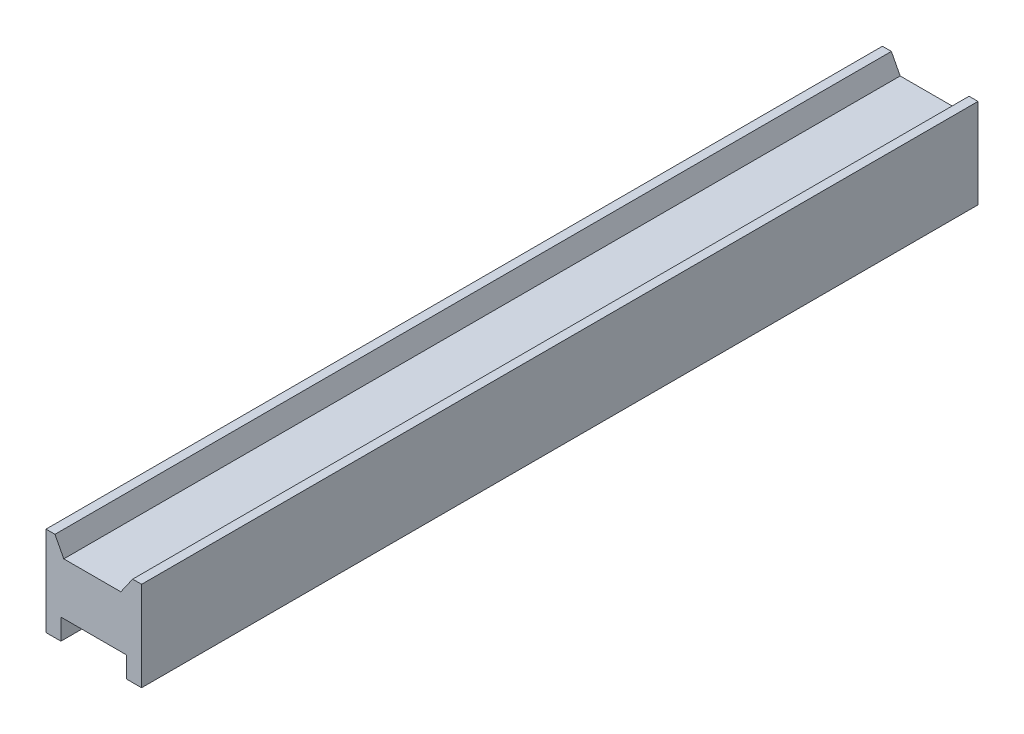
from build123d import *

# Parameters (mm, degrees)
SALIENTE_EXTRUIR1_DEPTH = 14000


with BuildPart() as part:
    # Croquis1 → Saliente-Extruir1 (new body)
    with BuildSketch(Plane.XY):
        Polygon((0, 0), (0, 1500), (150, 1500), (297.692749099, 1217.556378814), (1252.230847326, 1217.556378814), (1450, 1500), (1600, 1500), (1600, 0), (1350, 0), (1350, 350), (250, 350), (250, 0), align=None)
    extrude(amount=SALIENTE_EXTRUIR1_DEPTH)


solid = part.part
